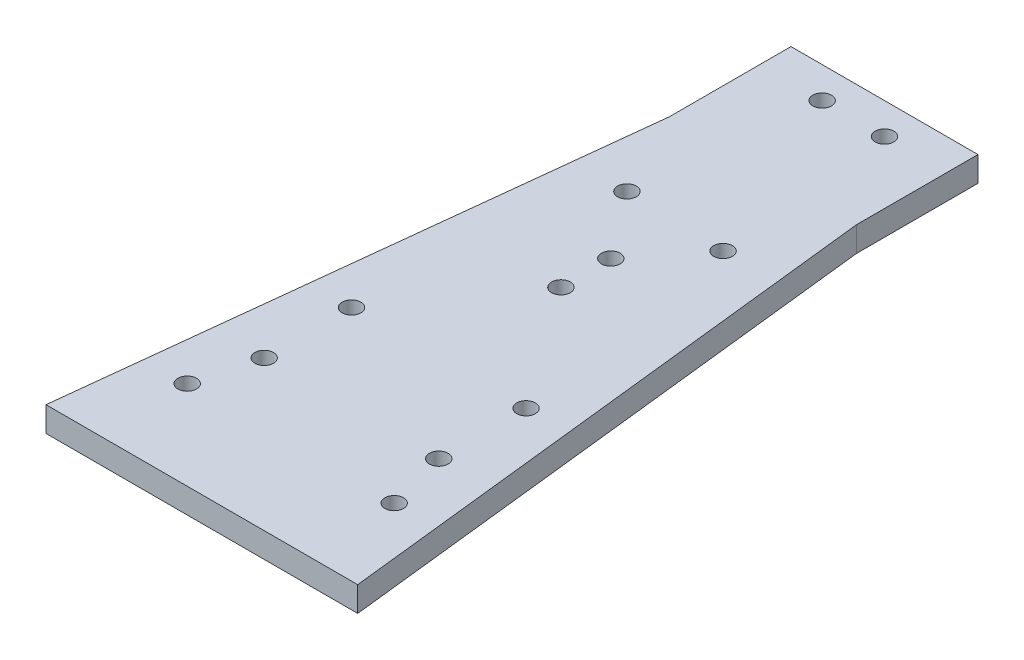
from build123d import *

# Parameters (mm, degrees)
EXTRUDE_1_DEPTH     = 4
SKETCH_4_R          = 1.5
CUT_EXTRUDE_3_DEPTH = 99.569772243
SKETCH_5_R          = 1.5
CUT_EXTRUDE_4_DEPTH = 99.569772243
SKETCH_9_R          = 1.5
CUT_EXTRUDE_6_DEPTH = 10
SKETCH_10_W         = 30
SKETCH_10_H         = 4
EXTRUDE_2_DEPTH     = 19.5
SKETCH_11_R         = 1.5
CUT_EXTRUDE_7_DEPTH = 99.569772243


with BuildPart() as part:
    # 草图1 → 凸台-拉伸1 (new body)
    with BuildSketch(Plane(origin=(0, 0, 0), x_dir=(1, 0, 0), z_dir=(0, 1, 0))):
        Polygon((0, 0), (30, 0), (40, -90), (-10, -90), align=None)
    extrude(amount=EXTRUDE_1_DEPTH)

    # 草图4 → 切除-拉伸3 (cut, through all)
    with BuildSketch(Plane(origin=(0, 4, 0), x_dir=(1, 0, 0), z_dir=(0, 1, 0))):
        with Locations(Location((1, -66, 0), (0, 0, 270))):
            Circle(SKETCH_4_R)
        with Locations(Location((1, -52, 0), (0, 0, 270))):
            Circle(SKETCH_4_R)
        with Locations(Location((29, -66, 0), (0, 0, 270))):
            Circle(SKETCH_4_R)
        with Locations(Location((29, -52, 0), (0, 0, 270))):
            Circle(SKETCH_4_R)
    extrude(amount=-CUT_EXTRUDE_3_DEPTH, mode=Mode.SUBTRACT)

    # 草图5 → 切除-拉伸4 (cut, through all)
    with BuildSketch(Plane(origin=(0, 4, 0), x_dir=(1, 0, 0), z_dir=(0, 1, 0))):
        with Locations(Location((15, -32.4, 0), (0, 0, 270))):
            Circle(SKETCH_5_R)
        with Locations(Location((15, -24.4, 0), (0, 0, 270))):
            Circle(SKETCH_5_R)
    extrude(amount=-CUT_EXTRUDE_4_DEPTH, mode=Mode.SUBTRACT)

    # 草图9 → 切除-拉伸6 (cut)
    with BuildSketch(Plane(origin=(0, 4, 0), x_dir=(1, 0, 0), z_dir=(0, 1, 0))):
        with Locations(Location((6.963154721, -13.77878744, 0), (0, 0, 270))):
            Circle(SKETCH_9_R)
        with Locations(Location((22.953054881, -14.34720003, 0), (0, 0, 270))):
            Circle(SKETCH_9_R)
        with Locations(Location((-1.6, -75.75, 0), (0, 0, 270))):
            Circle(SKETCH_9_R)
        with Locations(Location((31.6, -75.75, 0), (0, 0, 270))):
            Circle(SKETCH_9_R)
    extrude(amount=-CUT_EXTRUDE_6_DEPTH, mode=Mode.SUBTRACT)

    # 草图10 → 凸台-拉伸2 (add)
    with BuildSketch(Plane(origin=(0, 0, 0), x_dir=(-1, 0, 0), z_dir=(0, 0, -1))):
        with Locations((-15, 2)):
            Rectangle(SKETCH_10_W, SKETCH_10_H)
    extrude(amount=EXTRUDE_2_DEPTH)

    # 草图11 → 切除-拉伸7 (cut, through all)
    with BuildSketch(Plane.XZ):
        with Locations(Location((10, -14.5, 0), (0, 0, 270))):
            Circle(SKETCH_11_R)
        with Locations(Location((20, -14.5, 0), (0, 0, 270))):
            Circle(SKETCH_11_R)
    extrude(amount=-CUT_EXTRUDE_7_DEPTH, mode=Mode.SUBTRACT)


solid = part.part
